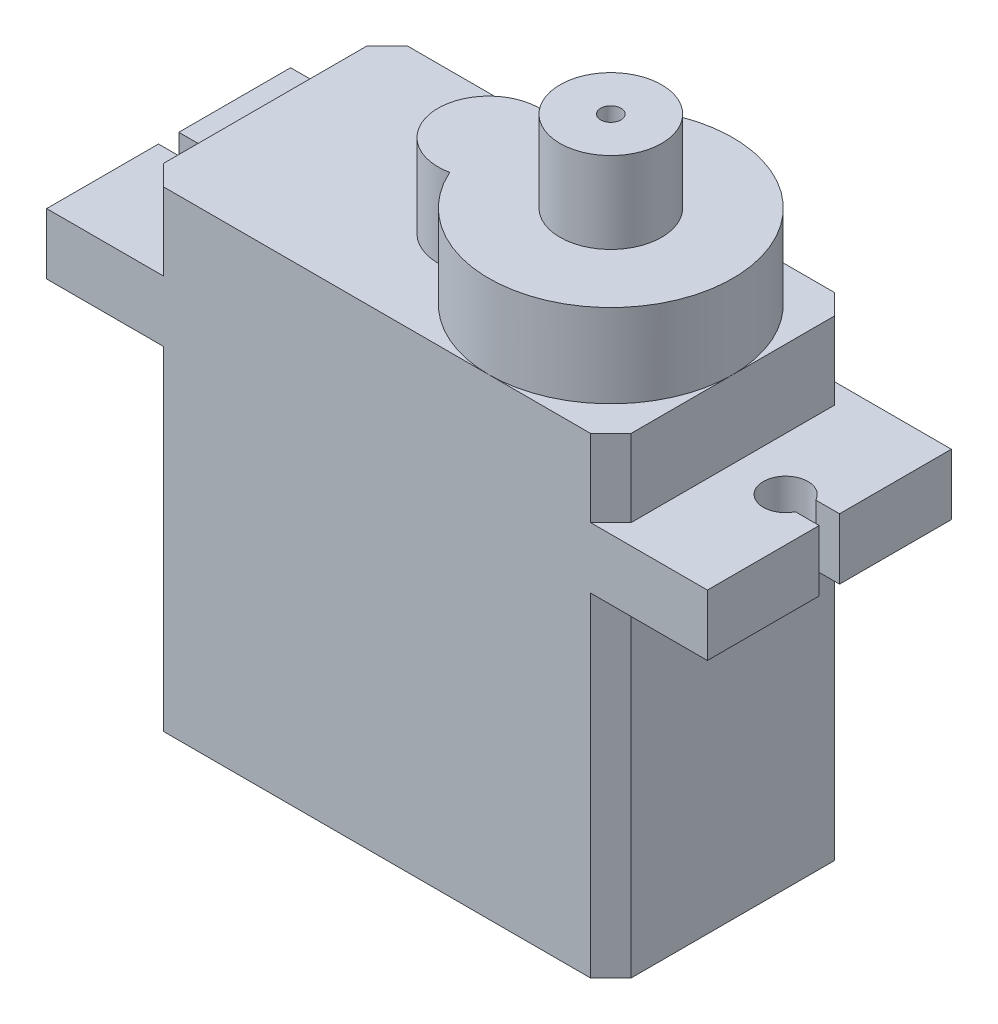
from build123d import *

# Parameters (mm, degrees)
CROQUIS1_W              = 23
CROQUIS1_H              = 12
SALIENTE_EXTRUIR1_DEPTH = 23.2
CROQUIS6_R              = 2
CORTAR_EXTRUIR1_DEPTH   = 0.5
SALIENTE_EXTRUIR3_DEPTH = 4.1
CROQUIS8_R              = 2.5
SALIENTE_EXTRUIR4_DEPTH = 4
CROQUIS9_R              = 0.5
CORTAR_EXTRUIR2_DEPTH   = 4
CROQUIS11_W             = 12
CROQUIS11_H             = 3
SALIENTE_EXTRUIR5_DEPTH = 4.75
CORTAR_EXTRUIR3_DEPTH   = 3
CHAFL_N3_SIZE           = 1


with BuildPart() as part:
    # Croquis1 → Saliente-Extruir1 (new body)
    with BuildSketch(Plane(origin=(0, 0, 0), x_dir=(1, 0, 0), z_dir=(0, 1, 0))):
        Rectangle(CROQUIS1_W, CROQUIS1_H)
    saliente_extruir1 = extrude(amount=SALIENTE_EXTRUIR1_DEPTH)

    # Croquis6 → Cortar-Extruir1 (cut)
    with BuildSketch(Plane.XZ):
        with Locations((-11.5, 6)):
            Circle(CROQUIS6_R)
        with Locations((11.5, 6)):
            Circle(CROQUIS6_R)
        with Locations((-11.5, -6)):
            Circle(CROQUIS6_R)
        with Locations((11.5, -6)):
            Circle(CROQUIS6_R)
    extrude(amount=-CORTAR_EXTRUIR1_DEPTH, mode=Mode.SUBTRACT)

    # Croquis7 → Saliente-Extruir3 (add)
    with BuildSketch(Plane(origin=(0, 23.2, 0), x_dir=(1, 0, 0), z_dir=(0, 1, 0))):
        with BuildLine():
            ThreePointArc((0.020833333, -2.445144707), (11.5, 0), (0.020833333, 2.445144707))
            ThreePointArc((0.020833333, 2.445144707), (-3, 0), (0.020833333, -2.445144707))
        make_face()
    extrude(amount=SALIENTE_EXTRUIR3_DEPTH)

    # Croquis8 → Saliente-Extruir4 (add)
    with BuildSketch(Plane(origin=(0, 27.3, 0), x_dir=(1, 0, 0), z_dir=(0, 1, 0))):
        with Locations(Location((5.5, 0, 0), (0, 0, 270))):
            Circle(CROQUIS8_R)
    extrude(amount=SALIENTE_EXTRUIR4_DEPTH)

    # Croquis9 → Cortar-Extruir2 (cut)
    with BuildSketch(Plane(origin=(0, 31.3, 0), x_dir=(1, 0, 0), z_dir=(0, 1, 0))):
        with Locations(Location((5.5, 0, 0), (0, 0, 270))):
            Circle(CROQUIS9_R)
    extrude(amount=-CORTAR_EXTRUIR2_DEPTH, mode=Mode.SUBTRACT)

    # Croquis11 → Saliente-Extruir5 (add)
    with BuildSketch(Plane.ZY.offset(11.5)):
        with Locations((0, 17.89988551)):
            Rectangle(CROQUIS11_W, CROQUIS11_H)
    saliente_extruir5 = extrude(amount=SALIENTE_EXTRUIR5_DEPTH)

    # Croquis12 → Cortar-Extruir3 (cut)
    with BuildSketch(Plane(origin=(0, 19.39988551, 0), x_dir=(1, 0, 0), z_dir=(0, 1, 0))):
        with BuildLine():
            Line((-16.25, 0.5), (-15.079795897, 0.5))
            ThreePointArc((-15.079795897, 0.5), (-13, 0), (-15.079795897, -0.5))
            Line((-15.079795897, -0.5), (-16.25, -0.5))
            Line((-16.25, -0.5), (-16.25, 0.5))
        make_face()
    cortar_extruir3 = extrude(amount=-CORTAR_EXTRUIR3_DEPTH, mode=Mode.SUBTRACT)

    # Simetría1: Saliente-Extruir1, Saliente-Extruir5, Cortar-Extruir3 across plane
    add(saliente_extruir1.mirror(Plane.ZY))
    add(saliente_extruir5.mirror(Plane.ZY))
    add(cortar_extruir3.mirror(Plane.ZY), mode=Mode.SUBTRACT)

    # Chaflán3
    chafl_n3_edges = [part.edges().sort_by_distance(p)[0] for p in [
        (11.5, 8.199942755, -6),
        (11.5, 8.199942755, 6),
        (-11.5, 8.199942755, 6),
        (-11.5, 8.199942755, -6),
        (-11.5, 21.299942755, -6),
        (11.5, 21.299942755, -6),
        (11.5, 21.299942755, 6),
        (-11.5, 21.299942755, 6),
    ]]
    chamfer(chafl_n3_edges, length=CHAFL_N3_SIZE)


solid = part.part
